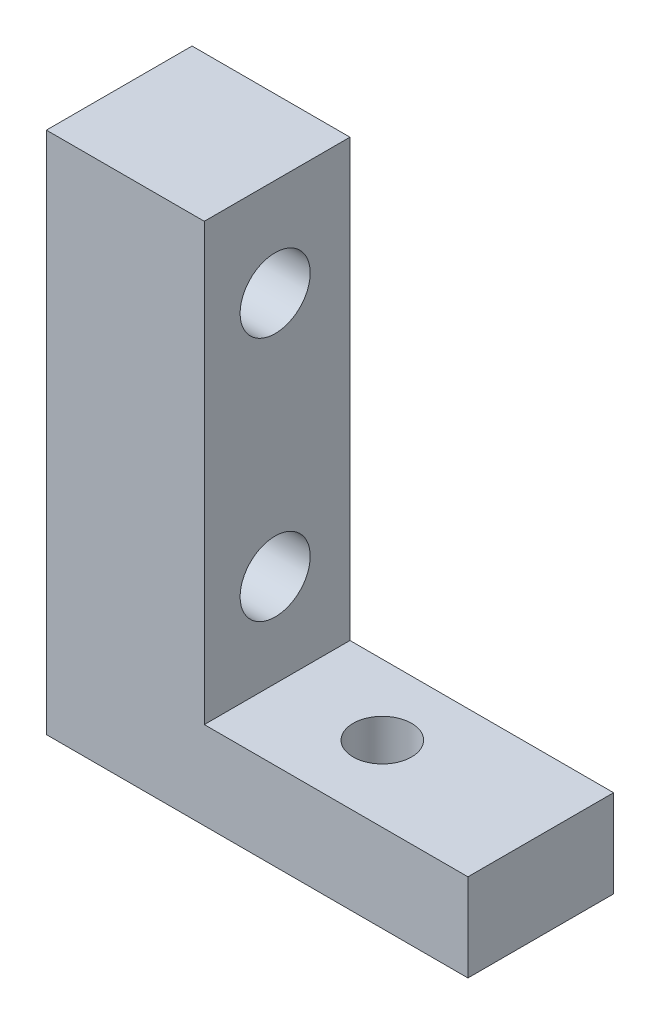
from build123d import *

# Parameters (mm, degrees)
SKETCH1_W           = 18.325664351
SKETCH1_H           = 6.332689346
SKETCH1_R           = 1.27
BOSS_EXTRUDE1_DEPTH = 3.81
SKETCH2_W           = 6.332689346
SKETCH2_H           = 18.949374656
SKETCH2_R           = 1.524
BOSS_EXTRUDE2_DEPTH = 6.864742327


with BuildPart() as part:
    # Sketch1 → Boss-Extrude1 (new body)
    with BuildSketch(Plane(origin=(0, 0, 0), x_dir=(1, 0, 0), z_dir=(0, 1, 0))):
        with Locations((9.162832176, 3.166344673)):
            Rectangle(SKETCH1_W, SKETCH1_H)
        with Locations(Location((11.320424566, 3.284411685, 0), (0, 0, 90))):
            Circle(SKETCH1_R, mode=Mode.SUBTRACT)
    extrude(amount=BOSS_EXTRUDE1_DEPTH)

    # Sketch2 → Boss-Extrude2 (add)
    with BuildSketch(Plane.ZY):
        with Locations((-3.166344673, 13.284687328)):
            Rectangle(SKETCH2_W, SKETCH2_H)
        with Locations((-3.080246652, 18.514377614)):
            Circle(SKETCH2_R, mode=Mode.SUBTRACT)
        with Locations((-3.080246652, 7.846377614)):
            Circle(SKETCH2_R, mode=Mode.SUBTRACT)
    extrude(amount=-BOSS_EXTRUDE2_DEPTH)


solid = part.part
